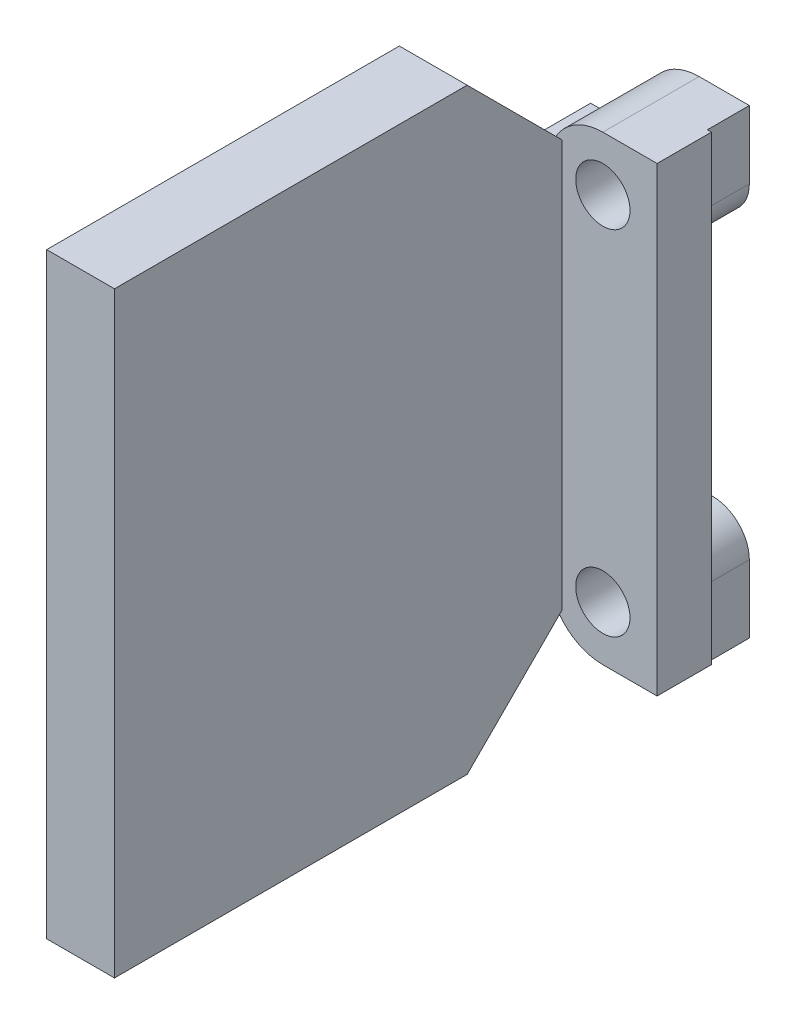
from build123d import *

# Parameters (mm, degrees)
SKETCH1_R           = 2
BOSS_EXTRUDE1_DEPTH = 4
BOSS_EXTRUDE2_START = 3.1
SKETCH2_R           = 2
BOSS_EXTRUDE2_DEPTH = 3.1
BOSS_EXTRUDE3_DEPTH = 5


with BuildPart() as part:
    # Sketch1 → Boss-Extrude1 (new body)
    with BuildSketch(Plane.XY):
        with BuildLine():
            Line((-44, 0), (-44, 9))
            ThreePointArc((-44, 9), (-41.171572875, 10.171572875), (-40, 13))
            ThreePointArc((-40, 13), (-38.828427125, 15.828427125), (-36, 17))
            Line((-36, 17), (-32, 17))
            Line((-32, 17), (-32, 0))
            Line((-32, 0), (-44, 0))
        make_face()
        with Locations((-36, 13)):
            Circle(SKETCH1_R, mode=Mode.SUBTRACT)
    extrude(amount=BOSS_EXTRUDE1_DEPTH)

    # Sketch2 → Boss-Extrude2 (add)
    with BuildSketch(Plane(origin=(0, 0, 0), x_dir=(-1, 0, 0), z_dir=(0, 0, -1)).offset(BOSS_EXTRUDE2_START)):
        with BuildLine():
            Line((35, 9.3), (42.480131585, 9.3))
            ThreePointArc((42.480131585, 9.3), (40.677390057, 10.772835172), (40, 13))
            ThreePointArc((40, 13), (38.828427125, 15.828427125), (36, 17))
            Line((36, 17), (32.3, 17))
            Line((32.3, 17), (32.3, 12))
            ThreePointArc((32.3, 12), (33.090811691, 10.090811691), (35, 9.3))
        make_face()
        with Locations(Location((36, 13, 0), (0, 0, 180))):
            Circle(SKETCH2_R, mode=Mode.SUBTRACT)
    extrude(amount=-BOSS_EXTRUDE2_DEPTH)

    # Sketch4 → Boss-Extrude3 (add)
    with BuildSketch(Plane(origin=(-44, -0.024459729, 0), x_dir=(0, 0, 1), z_dir=(1, 0, 0))):
        Polygon((0.3, -11.324459729), (11, -22.024459729), (37, -22.024459729), (37, -0.024459729), (0, -0.024459729), (0, -9.324459729), (-3.1, -9.324459729), (-3.1, -11.324459729), align=None)
    extrude(amount=BOSS_EXTRUDE3_DEPTH)

    # Mirror1: part across plane


with BuildPart() as part_1:
    add(part.part)
    add(part.part.mirror(Plane(origin=(-44, 0, 4), x_dir=(0, 0, 1), z_dir=(0, 1, 0))))


solid = part_1.part
